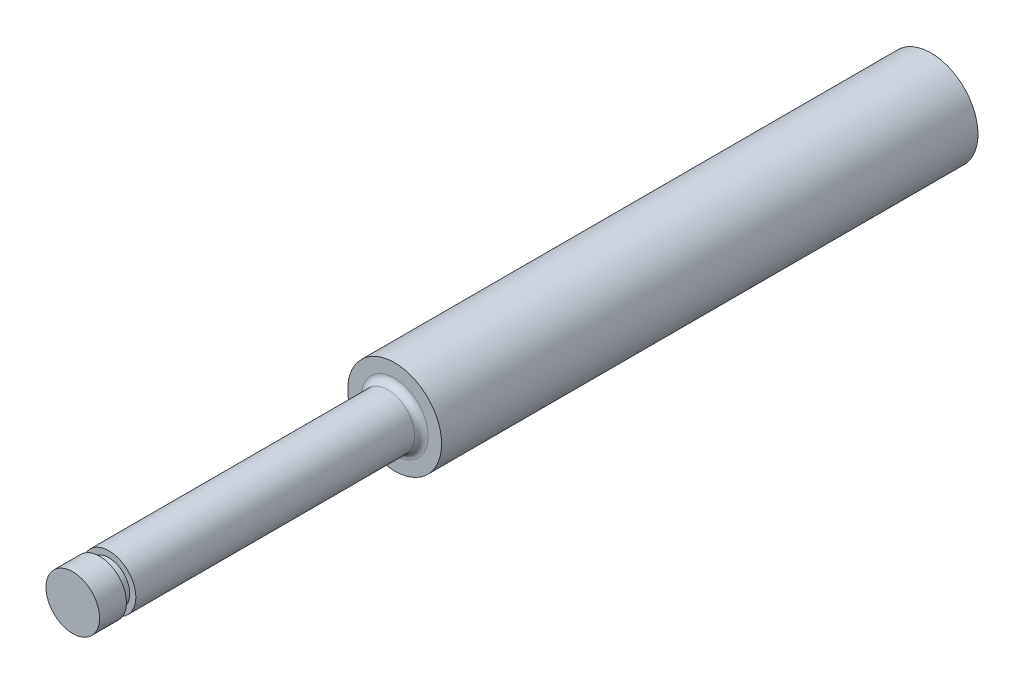
from build123d import *

# Parameters (mm, degrees)
ESQUISSE1_R          = 3.5
BASE_EXTRUSION_DEPTH = 40
ESQUISSE2_R          = 2
BOSS_EXTRU_1_DEPTH   = 61.3
ESQUISSE3_R          = 1.55
BOSS_EXTRU_2_DEPTH   = 0.7
ESQUISSE4_R          = 2
BOSS_EXTRU_3_DEPTH   = 2
CONG_1_R             = 0.5
PER_AGE1_D           = 1.5
PER_AGE1_DEPTH       = 11
PER_AGE1_CBORE_D     = 3
PER_AGE1_CBORE_DEPTH = 8
PER_AGE1_TIP         = 0.433012702


with BuildPart() as part:
    # Esquisse1 → Base-Extrusion (new body)
    with BuildSketch(Plane.XY):
        Circle(ESQUISSE1_R)
    extrude(amount=BASE_EXTRUSION_DEPTH)

    # Esquisse2 → Boss.-Extru.1 (add)
    with BuildSketch(Plane(origin=(0, 0, 0), x_dir=(-1, 0, 0), z_dir=(0, 0, -1))):
        Circle(ESQUISSE2_R)
    extrude(amount=-BOSS_EXTRU_1_DEPTH)

    # Esquisse3 → Boss.-Extru.2 (add)
    with BuildSketch(Plane.XY.offset(61.3)):
        Circle(ESQUISSE3_R)
    extrude(amount=BOSS_EXTRU_2_DEPTH)

    # Esquisse4 → Boss.-Extru.3 (add)
    with BuildSketch(Plane.XY.offset(62)):
        with Locations(Location((0, 0, 0), (0, 0, 180))):
            Circle(ESQUISSE4_R)
    extrude(amount=BOSS_EXTRU_3_DEPTH)

    # Congé1
    cong_1_edges = [part.edges().sort_by_distance(p)[0] for p in [
        (2, 0, 40),
    ]]
    fillet(cong_1_edges, radius=CONG_1_R)

    # Perçage1
    with Locations(Plane(origin=(0, 0, 0), x_dir=(-1, 0, 0), z_dir=(0, 0, -1))):
        with Locations((0, 0)):
            CounterBoreHole(PER_AGE1_D / 2, PER_AGE1_CBORE_D / 2, PER_AGE1_CBORE_DEPTH, depth=PER_AGE1_DEPTH)
            with Locations((0, 0, -(PER_AGE1_DEPTH + PER_AGE1_TIP / 2))):  # 120° drill point
                Cone(0, PER_AGE1_D / 2, PER_AGE1_TIP, mode=Mode.SUBTRACT)


solid = part.part
